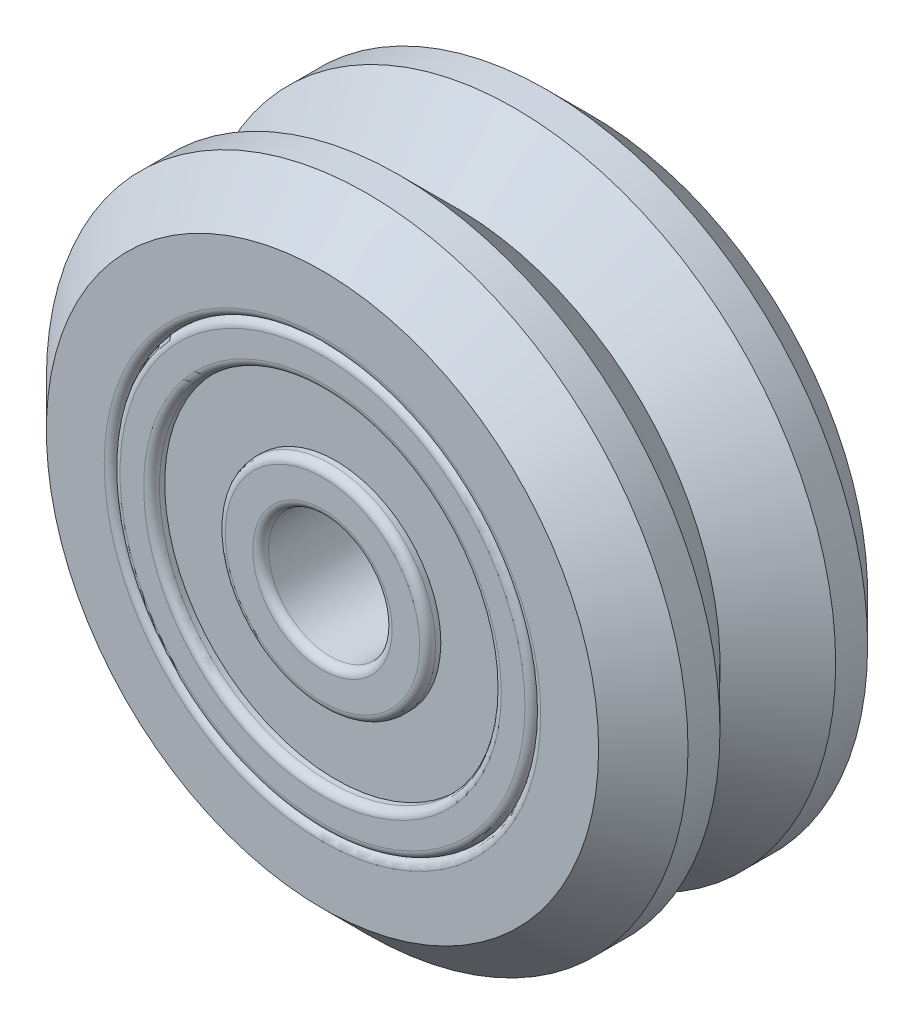
from build123d import *

# Parameters (mm, degrees)
SKETCH_1_R                    = 12.2
SKETCH_1_R_2                  = 7
EXTRUDE_1_DEPTH               = 10.23
SKETCH_2_OUTSIDE_W            = 38.438
SKETCH_2_OUTSIDE_H            = 38.438
SKETCH_2_OUTSIDE_R            = 10.5
CUT_EXTRUDE_1_DEPTH           = 2.42
CUT_EXTRUDE_1_DRAFT           = -45
SKETCH_4_OUTSIDE_W            = 38.438
SKETCH_4_OUTSIDE_H            = 38.438
SKETCH_4_OUTSIDE_R            = 10.5
CUT_EXTRUDE_2_DEPTH           = 2.42
CUT_EXTRUDE_2_DRAFT           = -45
SKETCH_8_R                    = 8
CUT_EXTRUDE_6_DEPTH           = 4.615
CUT_EXTRUDE_START             = -4.615
SKETCH_9_R                    = 8
CUT_EXTRUDE_7_DEPTH           = 4.615
SKETCH_7_OUTSIDE_W            = 38.988
SKETCH_7_OUTSIDE_H            = 38.988
SKETCH_7_OUTSIDE_R            = 10
CUT_EXTRUDE_5_DEPTH           = 2.695
CUT_EXTRUDE_5_TAPER           = 45
CUT_EXTRUDE_5_OTHER_WAY_DEPTH = 2.695
CUT_EXTRUDE_5_OTHER_WAY_TAPER = 45
FILLET_1_R                    = 0.3
SKETCH_10_R                   = 8
SKETCH_10_R_2                 = 2.35
EXTRUDE_2_DEPTH               = 4.615
SKETCH_11_R                   = 6.5
SKETCH_11_R_2                 = 4
CUT_EXTRUDE_8_DEPTH           = 0.5
FILLET_2_R                    = 0.3


with BuildPart() as part:
    # Эскиз1 → Бобышка-Вытянуть1 (new body)
    with BuildSketch(Plane.XY):
        Circle(SKETCH_1_R)
        Circle(SKETCH_1_R_2, mode=Mode.SUBTRACT)
    extrude(amount=EXTRUDE_1_DEPTH)


with BuildPart() as cut_extrude_1_tool:
    # Эскиз2 outside → Вырез-Вытянуть1 (with draft: the straight prism first)
    with BuildSketch(Plane.XY.offset(10.23)):
        Rectangle(SKETCH_2_OUTSIDE_W, SKETCH_2_OUTSIDE_H)
        Circle(SKETCH_2_OUTSIDE_R, mode=Mode.SUBTRACT)
    extrude(amount=-CUT_EXTRUDE_1_DEPTH)
    # Вырез-Вытянуть1: the draft: its side faces are tilted about the plane it starts from
    cut_extrude_1_sides = [cut_extrude_1_tool.faces().sort_by_distance(p)[0] for p in [
        (0, -19.219, 9.02),
        (19.219, 0, 9.02),
        (0, 19.219, 9.02),
        (-19.219, 0, 9.02),
        (-10.5, 0, 9.02),
    ]]
    draft(cut_extrude_1_sides, Plane.XY.offset(10.23), CUT_EXTRUDE_1_DRAFT)


with BuildPart() as part_1:
    add(part.part)

    # Вырез-Вытянуть1: cut by cut_extrude_1_tool
    add(cut_extrude_1_tool.part, mode=Mode.SUBTRACT)


with BuildPart() as cut_extrude_2_tool:
    # Эскиз4 outside → Вырез-Вытянуть2 (with draft: the straight prism first)
    with BuildSketch(Plane(origin=(0, 0, 0), x_dir=(-1, 0, 0), z_dir=(0, 0, -1))):
        Rectangle(SKETCH_4_OUTSIDE_W, SKETCH_4_OUTSIDE_H)
        Circle(SKETCH_4_OUTSIDE_R, mode=Mode.SUBTRACT)
    extrude(amount=-CUT_EXTRUDE_2_DEPTH)
    # Вырез-Вытянуть2: the draft: its side faces are tilted about the plane it starts from
    cut_extrude_2_sides = [cut_extrude_2_tool.faces().sort_by_distance(p)[0] for p in [
        (0, -19.219, 1.21),
        (-19.219, 0, 1.21),
        (0, 19.219, 1.21),
        (19.219, 0, 1.21),
        (10.5, 0, 1.21),
    ]]
    draft(cut_extrude_2_sides, Plane(origin=(0, 0, 0), x_dir=(-1, 0, 0), z_dir=(0, 0, -1)), CUT_EXTRUDE_2_DRAFT)


with BuildPart() as part_2:
    add(part_1.part)

    # Вырез-Вытянуть2: cut by cut_extrude_2_tool
    add(cut_extrude_2_tool.part, mode=Mode.SUBTRACT)

    # Эскиз8 → Вырез-Вытянуть6 (cut)
    with BuildSketch(Plane.XY.offset(10.23)):
        Circle(SKETCH_8_R)
    extrude(amount=-CUT_EXTRUDE_6_DEPTH, mode=Mode.SUBTRACT)

    # Эскиз9 → Вырез-Вытянуть7 (cut)
    with BuildSketch(Plane(origin=(0, 0, 0), x_dir=(-1, 0, 0), z_dir=(0, 0, -1)).offset(CUT_EXTRUDE_START)):
        with Locations(Location((0, 0, 0), (0, 0, 180))):
            Circle(SKETCH_9_R)
    extrude(amount=CUT_EXTRUDE_7_DEPTH, mode=Mode.SUBTRACT)

    # Эскиз7 outside → Вырез-Вытянуть5 (cut)
    with BuildSketch(Plane(origin=(0, 0, 5.115), x_dir=(-1, 0, 0), z_dir=(0, 0, -1))):
        Rectangle(SKETCH_7_OUTSIDE_W, SKETCH_7_OUTSIDE_H)
        Circle(SKETCH_7_OUTSIDE_R, mode=Mode.SUBTRACT)
    extrude(amount=CUT_EXTRUDE_5_DEPTH, taper=CUT_EXTRUDE_5_TAPER, mode=Mode.SUBTRACT)

    # Эскиз7 outside → Вырез-Вытянуть5 other way (cut)
    with BuildSketch(Plane(origin=(0, 0, 5.115), x_dir=(-1, 0, 0), z_dir=(0, 0, -1))):
        Rectangle(SKETCH_7_OUTSIDE_W, SKETCH_7_OUTSIDE_H)
        Circle(SKETCH_7_OUTSIDE_R, mode=Mode.SUBTRACT)
    extrude(amount=-CUT_EXTRUDE_5_OTHER_WAY_DEPTH, taper=CUT_EXTRUDE_5_OTHER_WAY_TAPER, mode=Mode.SUBTRACT)

    # Скругление1
    fillet_1_edges = [part_2.edges().sort_by_distance(p)[0] for p in [
        (-8, 0, 10.23),
        (-8, 0, 0),
    ]]
    fillet(fillet_1_edges, radius=FILLET_1_R)


with BuildPart() as body_2:
    # Эскиз10 → Бобышка-Вытянуть2 (new body)
    with BuildSketch(Plane.XY.offset(10.23)):
        Circle(SKETCH_10_R)
        Circle(SKETCH_10_R_2, mode=Mode.SUBTRACT)
    extrude(amount=-EXTRUDE_2_DEPTH)

    # Эскиз11 → Вырез-Вытянуть8 (cut)
    with BuildSketch(Plane.XY.offset(10.23)):
        Circle(SKETCH_11_R)
        Circle(SKETCH_11_R_2, mode=Mode.SUBTRACT)
    extrude(amount=-CUT_EXTRUDE_8_DEPTH, mode=Mode.SUBTRACT)

    # Скругление2
    fillet_2_edges = [body_2.edges().sort_by_distance(p)[0] for p in [
        (-6.5, 0, 10.23),
        (-4, 0, 10.23),
        (-8, 0, 10.23),
        (-2.35, 0, 10.23),
    ]]
    fillet(fillet_2_edges, radius=FILLET_2_R)


with BuildPart() as body_3:
    # Зеркальное отражение1: mirrored copy
    add(body_2.part.mirror(Plane(origin=(0, 0, 5.115), x_dir=(1, 0, 0), z_dir=(0, 0, -1))))


solid = Compound([part_2.part, body_2.part, body_3.part])
